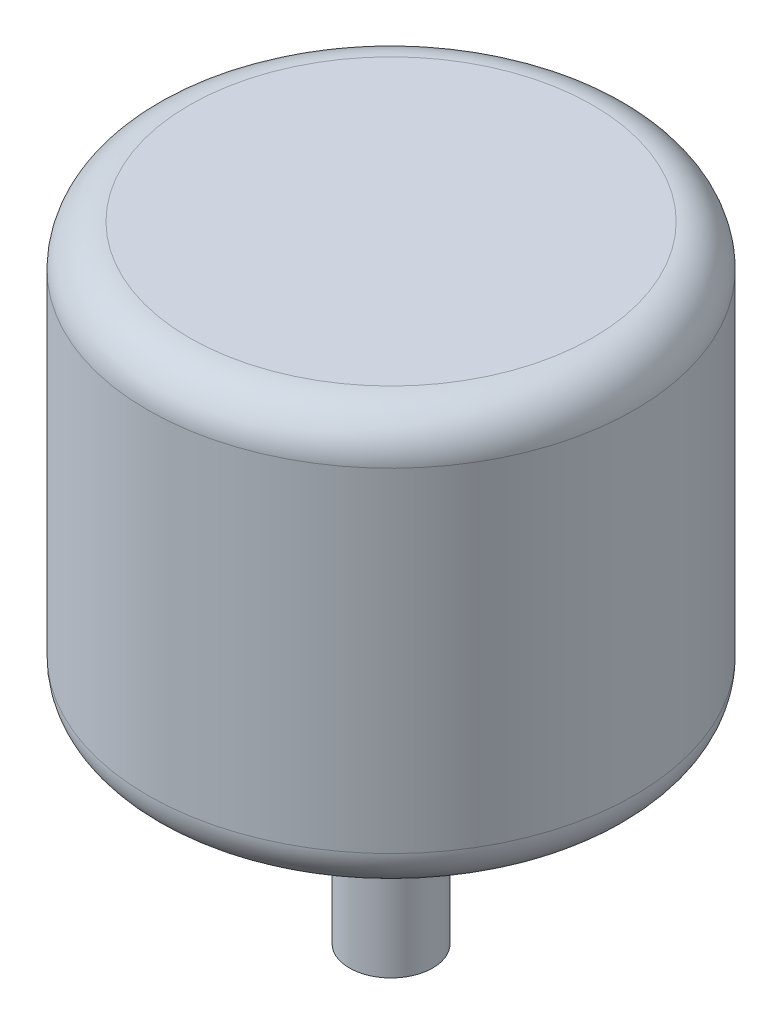
from build123d import *

# Parameters (mm, degrees)
SKETCH_1_R          = 17.5
EXTRUDE_1_DEPTH     = 30
SKETCH_2_R          = 3
EXTRUDE_2_DEPTH     = 15
FILLET_1_R          = 3
SKETCH_3_R          = 1.5
CUT_EXTRUDE_1_DEPTH = 10


with BuildPart() as part:
    # 草图1 → 凸台-拉伸1 (new body)
    with BuildSketch(Plane(origin=(0, 0, 0), x_dir=(1, 0, 0), z_dir=(0, 1, 0))):
        with Locations(Location((0, 0, 0), (0, 0, 270))):
            Circle(SKETCH_1_R)
    extrude(amount=EXTRUDE_1_DEPTH)

    # 草图2 → 凸台-拉伸2 (add)
    with BuildSketch(Plane(origin=(0, 0, 0), x_dir=(-1, 0, 0), z_dir=(0, -1, 0))):
        with Locations(Location((0, 0, 0), (0, 0, 90))):
            Circle(SKETCH_2_R)
    extrude(amount=EXTRUDE_2_DEPTH)

    # 圆角1
    fillet_1_edges = [part.edges().sort_by_distance(p)[0] for p in [
        (0, 0, -17.5),
        (0, 30, -17.5),
    ]]
    fillet(fillet_1_edges, radius=FILLET_1_R)

    # 草图3 → 切除-拉伸1 (cut)
    with BuildSketch(Plane(origin=(929.367009244, -2, 420.329827188), x_dir=(-0.9109625982496437, 0, -0.41248896299205207), z_dir=(0, -1, 0))):
        with Locations(Location((1012, -0.448882386, 0), (0, 0, 65.638716244))):
            Circle(SKETCH_3_R)
        with Locations(Location((1020, 7.551117614, 0), (0, 0, 65.638716244))):
            Circle(SKETCH_3_R)
        with Locations(Location((1028, -0.448882386, 0), (0, 0, 65.638716244))):
            Circle(SKETCH_3_R)
        with Locations(Location((1020, -8.448882386, 0), (0, 0, 65.638716244))):
            Circle(SKETCH_3_R)
    extrude(amount=-CUT_EXTRUDE_1_DEPTH, mode=Mode.SUBTRACT)


solid = part.part
